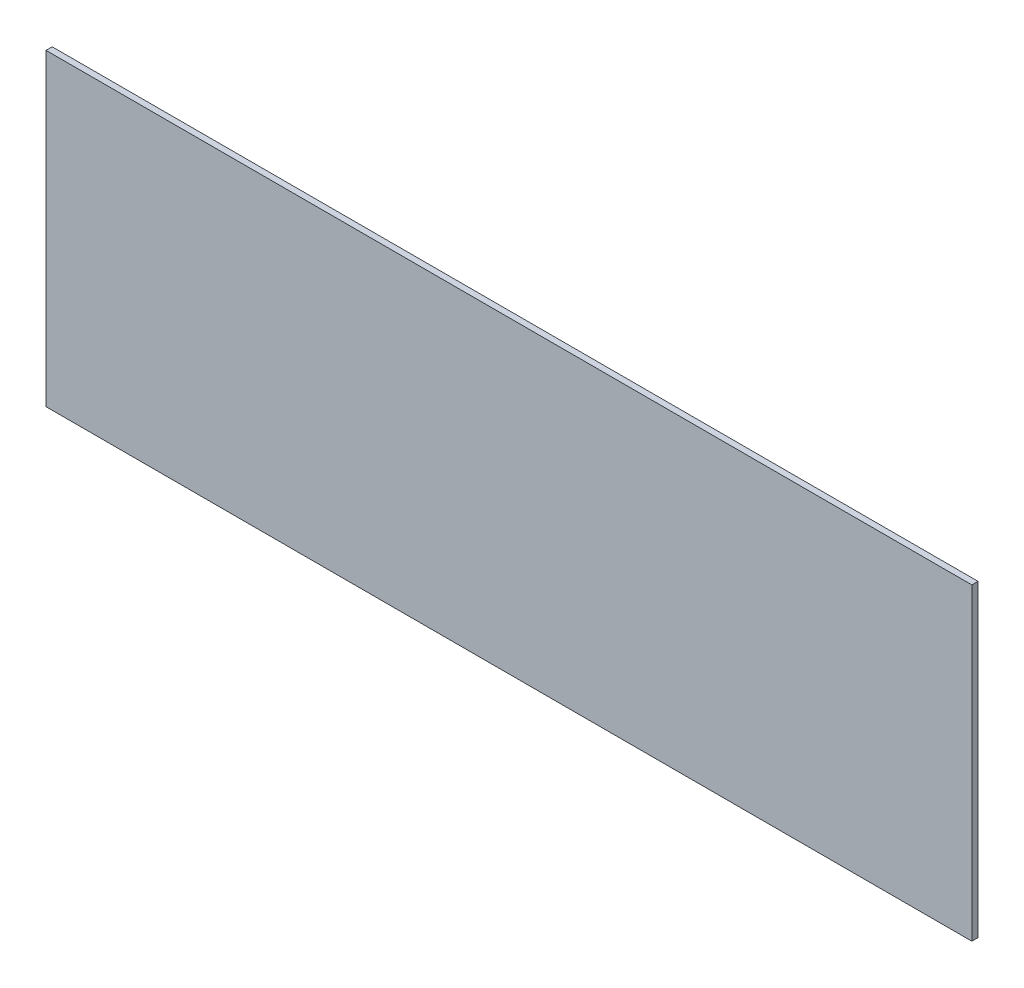
from build123d import *

# Parameters (mm, degrees)
SKETCH_1_W      = 75
SKETCH_1_H      = 25
EXTRUDE_1_DEPTH = 0.5


with BuildPart() as part:
    # 草图1 → 凸台-拉伸1 (new body)
    with BuildSketch(Plane.XY):
        Rectangle(SKETCH_1_W, SKETCH_1_H)
    extrude(amount=EXTRUDE_1_DEPTH)


solid = part.part
